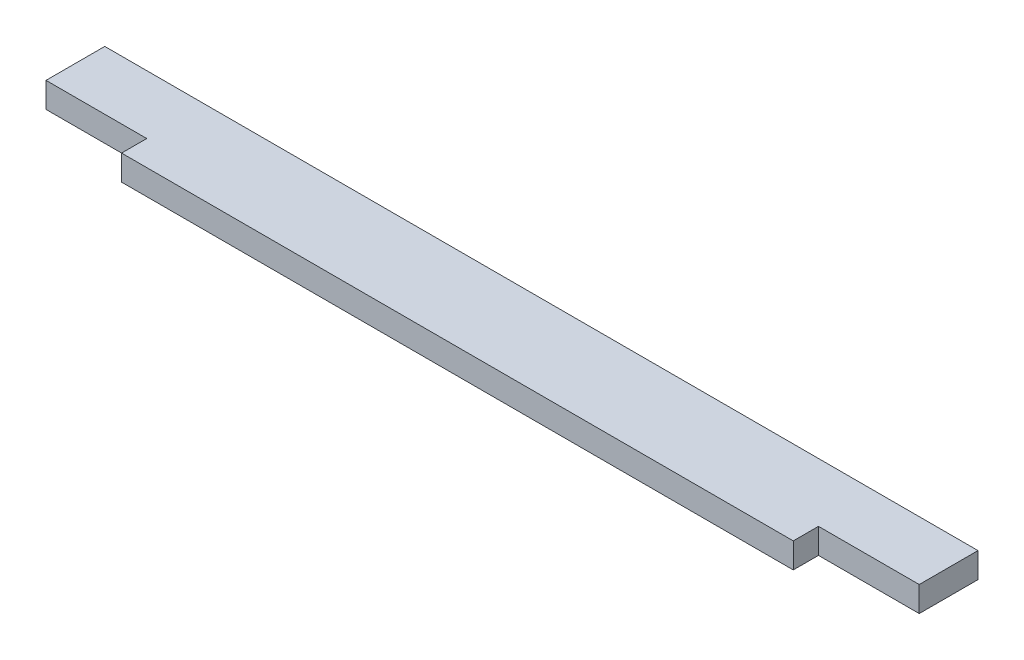
from build123d import *

# Parameters (mm, degrees)
SKETCH1_W           = 104
SKETCH1_H           = 10
BOSS_EXTRUDE1_DEPTH = 3
SKETCH2_W           = 12
SKETCH2_H           = 3
CUT_EXTRUDE2_DEPTH  = 53.325901808


with BuildPart() as part:
    # Sketch1 → Boss-Extrude1 (new body)
    with BuildSketch(Plane(origin=(0, 0, 0), x_dir=(1, 0, 0), z_dir=(0, 1, 0))):
        Rectangle(SKETCH1_W, SKETCH1_H)
    extrude(amount=BOSS_EXTRUDE1_DEPTH)

    # Sketch2 → Cut-Extrude2 (cut, through all)
    with BuildSketch(Plane(origin=(0, 3, 0), x_dir=(1, 0, 0), z_dir=(0, 1, 0))):
        with Locations((-46, -3.5)):
            Rectangle(SKETCH2_W, SKETCH2_H)
        with Locations((46, -3.5)):
            Rectangle(SKETCH2_W, SKETCH2_H)
    extrude(amount=-CUT_EXTRUDE2_DEPTH, mode=Mode.SUBTRACT)


solid = part.part
